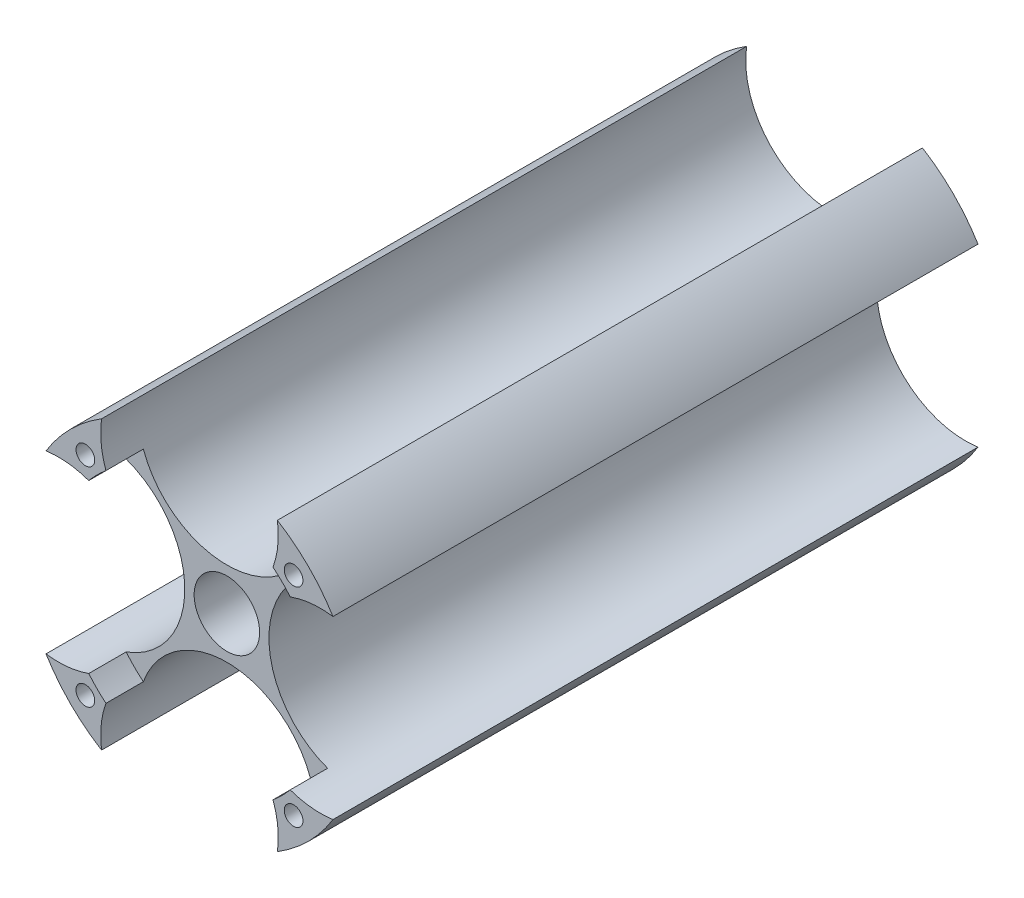
from build123d import *

# Parameters (mm, degrees)
SKETCH_1_R      = 1
SKETCH_1_R_2    = 3.5
EXTRUDE_1_DEPTH = 65
SKETCH_2_R      = 1
EXTRUDE_2_DEPTH = 4


with BuildPart() as part:
    # Эскиз1 → Бобышка-Вытянуть1 (new body)
    with BuildSketch(Plane.XY):
        with BuildLine():
            ThreePointArc((15.348214286, -9.403845928), (4.5, 0), (15.348214286, 9.403845928))
            ThreePointArc((15.348214286, 9.403845928), (12.727922061, 12.727922061), (9.403845928, 15.348214286))
            ThreePointArc((9.403845928, 15.348214286), (9.475930992, 14.675819385), (9.5, 14))
            ThreePointArc((9.5, 14), (-0.675819385, 4.524069008), (-9.403845928, 15.348214286))
            ThreePointArc((-9.403845928, 15.348214286), (-12.727922061, 12.727922061), (-15.348214286, 9.403845928))
            ThreePointArc((-15.348214286, 9.403845928), (-7.777381408, 7.178371532), (-4.5, 0))
            ThreePointArc((-4.5, 0), (-7.777381408, -7.178371532), (-15.348214286, -9.403845928))
            ThreePointArc((-15.348214286, -9.403845928), (-12.727922061, -12.727922061), (-9.403845928, -15.348214286))
            ThreePointArc((-9.403845928, -15.348214286), (-0.675819385, -4.524069008), (9.5, -14))
            ThreePointArc((9.5, -14), (9.475930992, -14.675819385), (9.403845928, -15.348214286))
            ThreePointArc((9.403845928, -15.348214286), (12.727922061, -12.727922061), (15.348214286, -9.403845928))
        make_face()
        with Locations((-11.136931804, -11.136931804)):
            Circle(SKETCH_1_R, mode=Mode.SUBTRACT)
        with Locations((11.136931804, -11.136931804)):
            Circle(SKETCH_1_R, mode=Mode.SUBTRACT)
        Circle(SKETCH_1_R_2, mode=Mode.SUBTRACT)
        with Locations((-11.136931804, 11.136931804)):
            Circle(SKETCH_1_R, mode=Mode.SUBTRACT)
        with Locations((11.136931804, 11.136931804)):
            Circle(SKETCH_1_R, mode=Mode.SUBTRACT)
    extrude(amount=EXTRUDE_1_DEPTH)

    # Эскиз2 → Бобышка-Вытянуть2 (add)
    # profile 1 of 4: a face of its own
    with BuildSketch(Plane.XY.offset(65)):
        with BuildLine():
            ThreePointArc((-9.403845928, -15.348214286), (-9.450740121, -13.033816183), (-8.936492023, -10.776785714))
            ThreePointArc((-8.936492023, -10.776785714), (-9.899494937, -9.899494937), (-10.776785714, -8.936492023))
            ThreePointArc((-10.776785714, -8.936492023), (-13.033816183, -9.450740121), (-15.348214286, -9.403845928))
            ThreePointArc((-15.348214286, -9.403845928), (-12.727922061, -12.727922061), (-9.403845928, -15.348214286))
        make_face()
        with Locations((-11.136931804, -11.136931804)):
            Circle(SKETCH_2_R, mode=Mode.SUBTRACT)
    # profile 2 of 4: a face of its own
    with BuildSketch(Plane.XY.offset(65)):
        with BuildLine():
            ThreePointArc((15.348214286, -9.403845928), (13.033816183, -9.450740121), (10.776785714, -8.936492023))
            ThreePointArc((10.776785714, -8.936492023), (9.899494937, -9.899494937), (8.936492023, -10.776785714))
            ThreePointArc((8.936492023, -10.776785714), (9.358062679, -12.363948994), (9.5, -14))
            ThreePointArc((9.5, -14), (9.475930992, -14.675819385), (9.403845928, -15.348214286))
            ThreePointArc((9.403845928, -15.348214286), (12.727922061, -12.727922061), (15.348214286, -9.403845928))
        make_face()
        with Locations((11.136931804, -11.136931804)):
            Circle(SKETCH_2_R, mode=Mode.SUBTRACT)
    # profile 3 of 4: a face of its own
    with BuildSketch(Plane.XY.offset(65)):
        with BuildLine():
            ThreePointArc((8.936492023, 10.776785714), (9.899494937, 9.899494937), (10.776785714, 8.936492023))
            ThreePointArc((10.776785714, 8.936492023), (13.033816183, 9.450740121), (15.348214286, 9.403845928))
            ThreePointArc((15.348214286, 9.403845928), (12.727922061, 12.727922061), (9.403845928, 15.348214286))
            ThreePointArc((9.403845928, 15.348214286), (9.475930992, 14.675819385), (9.5, 14))
            ThreePointArc((9.5, 14), (9.358062679, 12.363948994), (8.936492023, 10.776785714))
        make_face()
        with Locations((11.136931804, 11.136931804)):
            Circle(SKETCH_2_R, mode=Mode.SUBTRACT)
    # profile 4 of 4: a face of its own
    with BuildSketch(Plane.XY.offset(65)):
        with BuildLine():
            ThreePointArc((-10.776785714, 8.936492023), (-9.899494937, 9.899494937), (-8.936492023, 10.776785714))
            ThreePointArc((-8.936492023, 10.776785714), (-9.450740121, 13.033816183), (-9.403845928, 15.348214286))
            ThreePointArc((-9.403845928, 15.348214286), (-12.727922061, 12.727922061), (-15.348214286, 9.403845928))
            ThreePointArc((-15.348214286, 9.403845928), (-13.033816183, 9.450740121), (-10.776785714, 8.936492023))
        make_face()
        with Locations((-11.136931804, 11.136931804)):
            Circle(SKETCH_2_R, mode=Mode.SUBTRACT)
    extrude(amount=EXTRUDE_2_DEPTH)


solid = part.part
